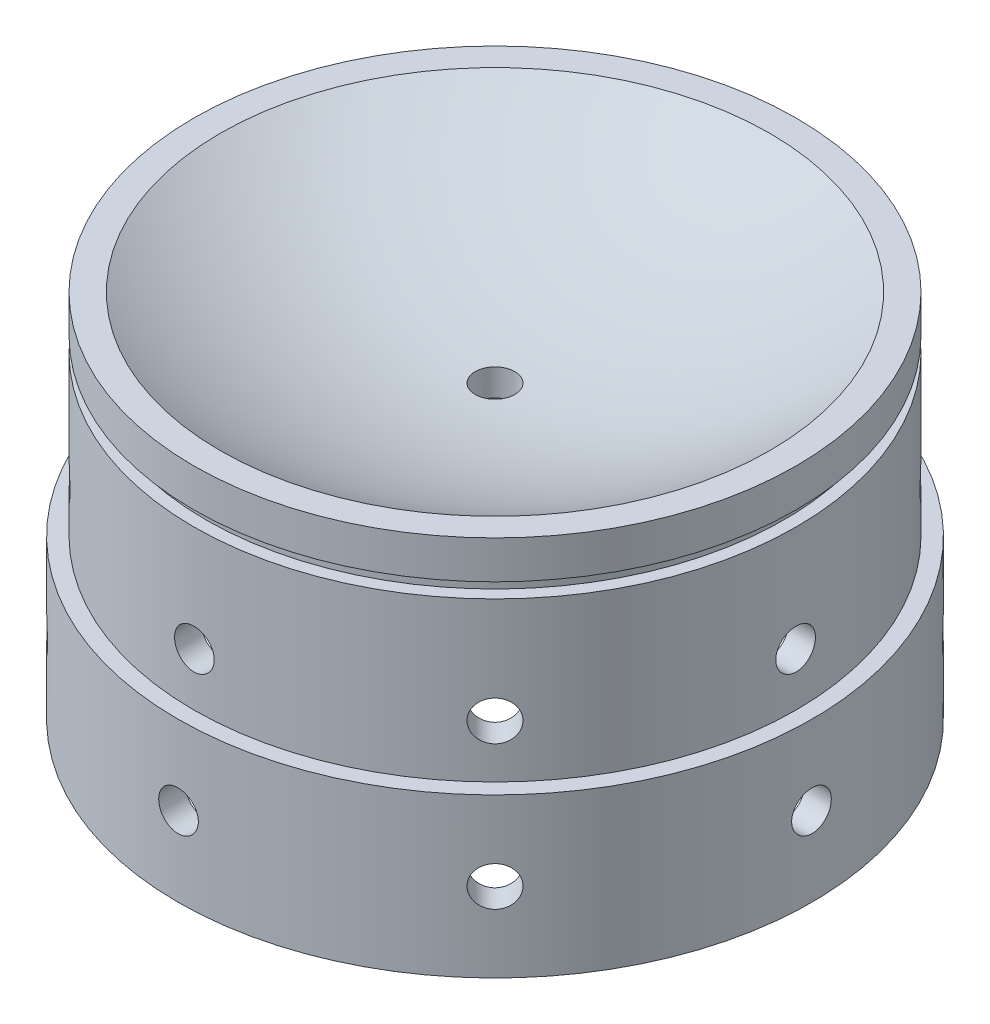
from build123d import *

# Parameters (mm, degrees)
MAIN_LINE_HOLE_REACH      = 127.08
MAIN_LINE_HOLE_END_RADIUS = 123.994333333
SKETCH10_R                = 4.7625
CHAMFER1_SIZE             = 2.54
CIRPATTERN1_COUNT         = 8


with BuildPart() as part:
    # Sketch1 → Revolve1 (revolve)
    with BuildSketch(Plane.XY):
        with BuildLine():
            Line((0, 6.35), (0, 0))
            Line((0, 0), (66.04, 0))
            Line((66.04, 0), (66.04, -25.4))
            Line((66.04, -25.4), (69.85, -25.4))
            Line((69.85, -25.4), (69.85, -63.5))
            Line((69.85, -63.5), (76.2, -63.5))
            Line((76.2, -63.5), (76.2, -25.4))
            Line((76.2, -25.4), (72.39, -25.4))
            Line((72.39, -25.4), (72.39, 12.7))
            Line((72.39, 12.7), (69.469, 12.7))
            Line((69.469, 12.7), (69.469, 16.256))
            Line((69.469, 16.256), (72.39, 16.256))
            Line((72.39, 16.256), (72.39, 25.4))
            Line((72.39, 25.4), (66.04, 25.4))
            ThreePointArc((66.04, 25.4), (34.366350184, 11.207652694), (0, 6.35))
        make_face()
    revolve(axis=Axis((0, 0, 0), (0, 1, 0)))

    # Sketch8 → 3/8 (0.375) Diameter Hole1 (revolve, cut)
    with BuildSketch(Plane(origin=(72.39, -12.7, 0), x_dir=(0, 0, -1), z_dir=(0, 1, 0))):
        Polygon((0, 0), (0, 75.250598698), (4.7625, 72.389), (4.7625, 0), align=None)
    f_3_8_0_375_diameter_hole1 = revolve(axis=Axis((78.74, -12.7, 0), (-1, 0, 0)), mode=Mode.SUBTRACT)

    # Sketch9 → 3/8 (0.375) Diameter Hole2 (revolve, cut)
    with BuildSketch(Plane(origin=(76.2, -44.45, 0), x_dir=(0, 0, -1), z_dir=(0, 1, 0))):
        Polygon((0, 0), (0, 79.060598698), (4.7625, 76.199), (4.7625, 0), align=None)
    f_3_8_0_375_diameter_hole2 = revolve(axis=Axis((82.55, -44.45, 0), (-1, 0, 0)), mode=Mode.SUBTRACT)

    # Main Line Hole: up to this sphere (the profile starts outside it)
    main_line_hole_end = Location((0, 130.344333333, 0)) * Sphere(MAIN_LINE_HOLE_END_RADIUS, mode=Mode.PRIVATE)
    # Sketch10 → Main Line Hole (cut, up to the surface)
    with BuildSketch(Plane.XZ, mode=Mode.PRIVATE) as main_line_hole_sk1:
        Circle(SKETCH10_R)
    main_line_hole_tool1 = extrude(main_line_hole_sk1.sketch, amount=-MAIN_LINE_HOLE_REACH, mode=Mode.PRIVATE) - main_line_hole_end
    add(main_line_hole_tool1.solids().sort_by_distance((0, 0, 0))[0], mode=Mode.SUBTRACT)

    # Chamfer1
    chamfer1_edges = [part.edges().sort_by_distance(p)[0] for p in [
        (-69.85, -25.4, 0),
    ]]
    chamfer(chamfer1_edges, length=CHAMFER1_SIZE)

    # CirPattern1: 3/8 (0.375) Diameter Hole1, 3/8 (0.375) Diameter Hole2 ×8 about axis
    cirpattern1_axis = Axis((0, -25.4, 0), (0, -1, 0))
    add([f_3_8_0_375_diameter_hole1.rotate(cirpattern1_axis, i * 360 / CIRPATTERN1_COUNT) for i in range(1, CIRPATTERN1_COUNT)], mode=Mode.SUBTRACT)
    add([f_3_8_0_375_diameter_hole2.rotate(cirpattern1_axis, i * 360 / CIRPATTERN1_COUNT) for i in range(1, CIRPATTERN1_COUNT)], mode=Mode.SUBTRACT)


solid = part.part
